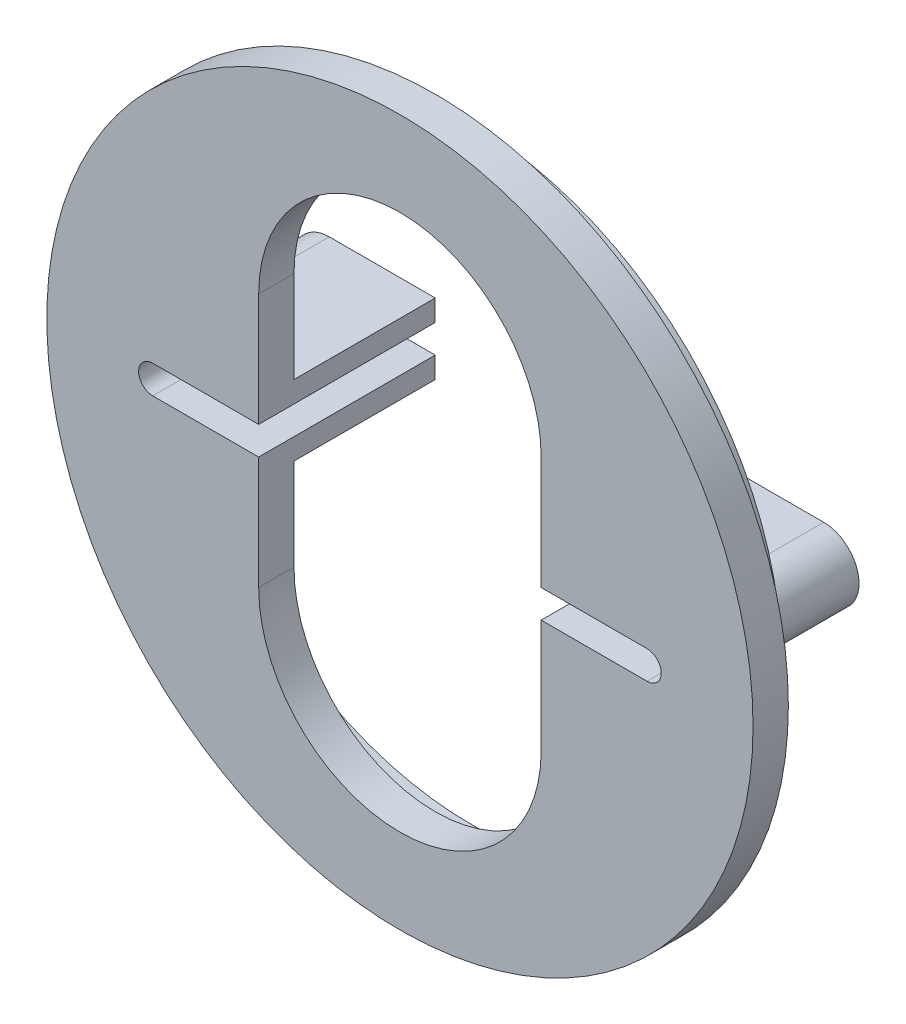
from build123d import *

# Parameters (mm, degrees)
ESBO_O1_R                = 50
RESSALTO_EXTRUS_O1_DEPTH = 5
RESSALTO_EXTRUS_O2_START = -20
RESSALTO_EXTRUS_O2_DEPTH = 20
ESBO_O1_4_R              = 44
ESBO_O1_4_R_2            = 42
RESSALTO_EXTRUS_O3_DEPTH = 5


with BuildPart() as part:
    # Esboço1 → Ressalto-extrusão1 (new body)
    with BuildSketch(Plane.XY):
        Circle(ESBO_O1_R)
        with BuildLine():
            ThreePointArc((20, -18), (0, -38), (-20, -18))
            Line((-20, -18), (-20, -2))
            Line((-20, -2), (-35, -2))
            ThreePointArc((-35, -2), (-37, 0), (-35, 2))
            Line((-35, 2), (-20, 2))
            Line((-20, 2), (-20, 18))
            ThreePointArc((-20, 18), (0, 38), (20, 18))
            Line((20, 18), (20, 2))
            Line((20, 2), (35, 2))
            ThreePointArc((35, 2), (37, 0), (35, -2))
            Line((35, -2), (20, -2))
            Line((20, -2), (20, -18))
        make_face(mode=Mode.SUBTRACT)
    extrude(amount=RESSALTO_EXTRUS_O1_DEPTH)

    # Esboço1<3> → Ressalto-extrusão2 (add)
    with BuildSketch(Plane.XY.offset(RESSALTO_EXTRUS_O2_START)):
        with BuildLine():
            ThreePointArc((35, 2), (37, 0), (35, -2))
            Line((35, -2), (20, -2))
            Line((20, -2), (20, -5))
            Line((20, -5), (35, -5))
            ThreePointArc((35, -5), (40, 0), (35, 5))
            Line((35, 5), (20, 5))
            Line((20, 5), (20, 2))
            Line((20, 2), (35, 2))
        make_face()
        with BuildLine():
            Line((-35, -5), (-20, -5))
            Line((-20, -5), (-20, -2))
            Line((-20, -2), (-35, -2))
            ThreePointArc((-35, -2), (-37, 0), (-35, 2))
            Line((-35, 2), (-20, 2))
            Line((-20, 2), (-20, 5))
            Line((-20, 5), (-35, 5))
            ThreePointArc((-35, 5), (-40, 0), (-35, -5))
        make_face()
    extrude(amount=RESSALTO_EXTRUS_O2_DEPTH)

    # Esboço1<4> → Ressalto-extrusão3 (add)
    with BuildSketch(Plane.XY):
        Circle(ESBO_O1_4_R)
        Circle(ESBO_O1_4_R_2, mode=Mode.SUBTRACT)
    extrude(amount=-RESSALTO_EXTRUS_O3_DEPTH)


solid = part.part
